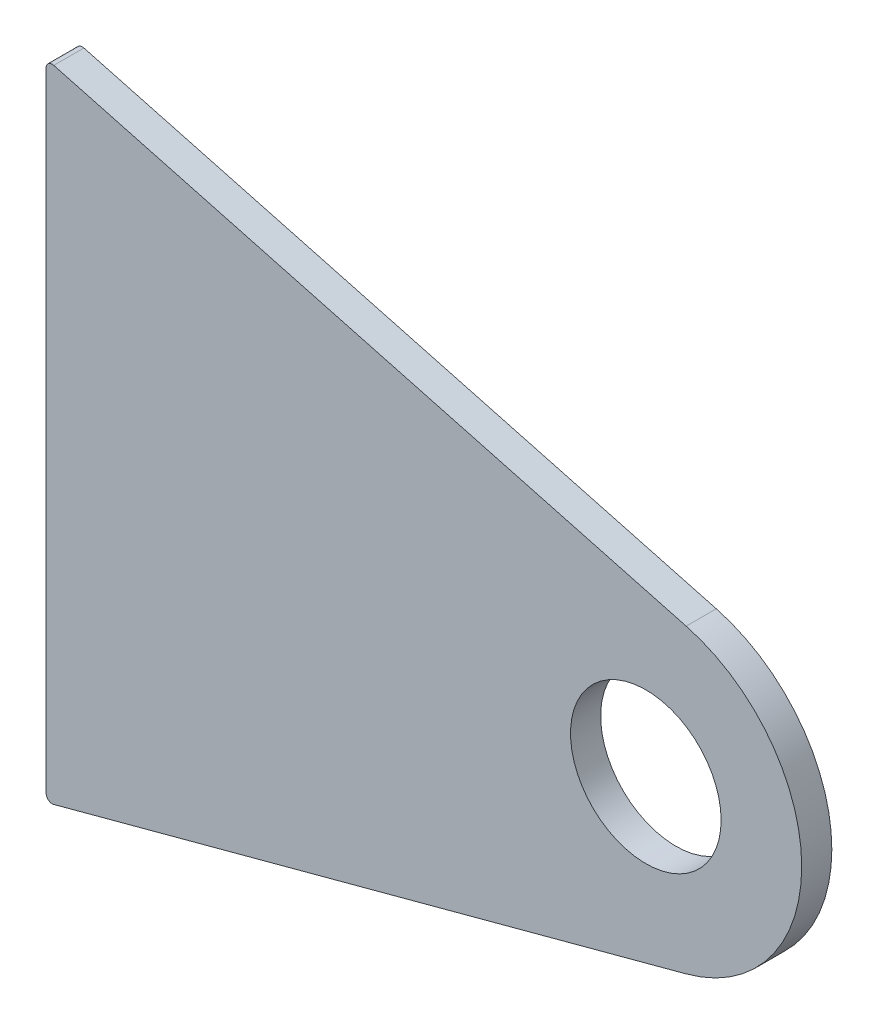
from build123d import *

# Parameters (mm, degrees)
SKETCH1_R           = 25
BOSS_EXTRUDE2_DEPTH = 10
FILLET2_R           = 2


with BuildPart() as part:
    # Sketch1 → Boss-Extrude2 (new body)
    with BuildSketch(Plane.XY):
        with BuildLine():
            Line((-199.106222162, -106.940189923), (13.397459622, -50))
            ThreePointArc((13.397459622, -50), (41.066990793, -31.51181035), (51.763809021, 0))
            ThreePointArc((51.763809021, 0), (41.066990793, 31.51181035), (13.397459622, 50))
            Line((13.397459622, 50), (-199.106222162, 106.940189923))
            Line((-199.106222162, 106.940189923), (-199.106222162, -106.940189923))
        make_face()
        Circle(SKETCH1_R, mode=Mode.SUBTRACT)
    extrude(amount=BOSS_EXTRUDE2_DEPTH)

    # Fillet2
    fillet2_edges = [part.edges().sort_by_distance(p)[0] for p in [
        (-199.106222162, -106.940189923, 5),
        (-199.106222162, 106.940189923, 5),
    ]]
    fillet(fillet2_edges, radius=FILLET2_R)


solid = part.part
